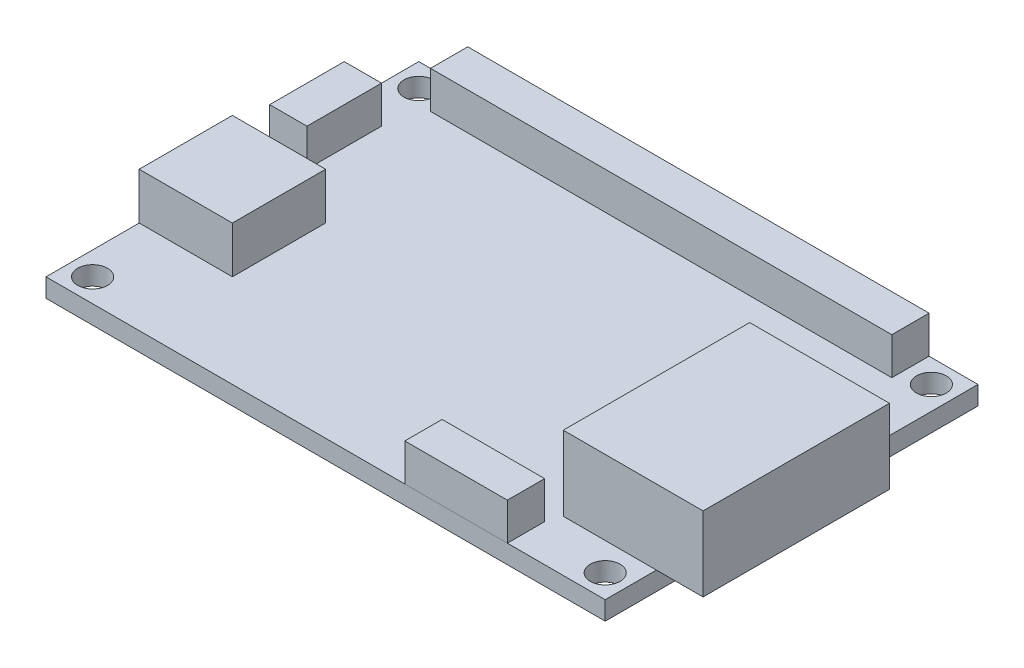
from build123d import *

# Parameters (mm, degrees)
SKETCH_1_W        = 60
SKETCH_1_H        = 40
SKETCH_1_R        = 1.6
EXTRUDE_1_DEPTH   = 2
SKETCH_2_W        = 49.5
SKETCH_2_H        = 4
EXTRUDE_2_DEPTH   = 4
SKETCH_2_W_2      = 4
SKETCH_2_H_2      = 8
EXTRUDE_2_2_DEPTH = 4
SKETCH_2_W_3      = 11
EXTRUDE_2_3_DEPTH = 4
SKETCH_2_3_W      = 10
SKETCH_2_3_H      = 10
EXTRUDE_3_DEPTH   = 5
SKETCH_2_4_W      = 15
SKETCH_2_4_H      = 20
EXTRUDE_4_DEPTH   = 8


with BuildPart() as part:
    # 草图1 → 凸台-拉伸1 (new body)
    with BuildSketch(Plane(origin=(0, 0, 0), x_dir=(1, 0, 0), z_dir=(0, 1, 0))):
        Rectangle(SKETCH_1_W, SKETCH_1_H)
        with Locations((-27.5, 17.5)):
            Circle(SKETCH_1_R, mode=Mode.SUBTRACT)
        with Locations((27.5, 17.5)):
            Circle(SKETCH_1_R, mode=Mode.SUBTRACT)
        with Locations((27.5, -17.5)):
            Circle(SKETCH_1_R, mode=Mode.SUBTRACT)
        with Locations((-27.5, -17.5)):
            Circle(SKETCH_1_R, mode=Mode.SUBTRACT)
    extrude(amount=EXTRUDE_1_DEPTH)


with BuildPart() as body_2:
    # 草图2 → 凸台-拉伸2 (new body)
    with BuildSketch(Plane(origin=(0, 2, 0), x_dir=(1, 0, 0), z_dir=(0, 1, 0))):
        with Locations((0, 18)):
            Rectangle(SKETCH_2_W, SKETCH_2_H)
    extrude(amount=EXTRUDE_2_DEPTH)


with BuildPart() as body_3:
    # 草图2 → Extrude 2 2 (new body)
    with BuildSketch(Plane(origin=(0, 2, 0), x_dir=(1, 0, 0), z_dir=(0, 1, 0))):
        with Locations((-28, 8)):
            Rectangle(SKETCH_2_W_2, SKETCH_2_H_2)
    extrude(amount=EXTRUDE_2_2_DEPTH)


with BuildPart() as body_4:
    # 草图2 → Extrude 2 3 (new body)
    with BuildSketch(Plane(origin=(0, 2, 0), x_dir=(1, 0, 0), z_dir=(0, 1, 0))):
        with Locations((14, -18)):
            Rectangle(SKETCH_2_W_3, SKETCH_2_H)
    extrude(amount=EXTRUDE_2_3_DEPTH)


with BuildPart() as body_5:
    # 草图2<3> → 凸台-拉伸3 (new body)
    with BuildSketch(Plane(origin=(0, 2, 0), x_dir=(1, 0, 0), z_dir=(0, 1, 0))):
        with Locations((-25, -5)):
            Rectangle(SKETCH_2_3_W, SKETCH_2_3_H)
    extrude(amount=EXTRUDE_3_DEPTH)


with BuildPart() as body_6:
    # 草图2<4> → 凸台-拉伸4 (new body)
    with BuildSketch(Plane(origin=(0, 2, 0), x_dir=(1, 0, 0), z_dir=(0, 1, 0))):
        with Locations((27.5, -4.5)):
            Rectangle(SKETCH_2_4_W, SKETCH_2_4_H)
    extrude(amount=EXTRUDE_4_DEPTH)


solid = Compound([part.part, body_2.part, body_3.part, body_4.part, body_5.part, body_6.part])
